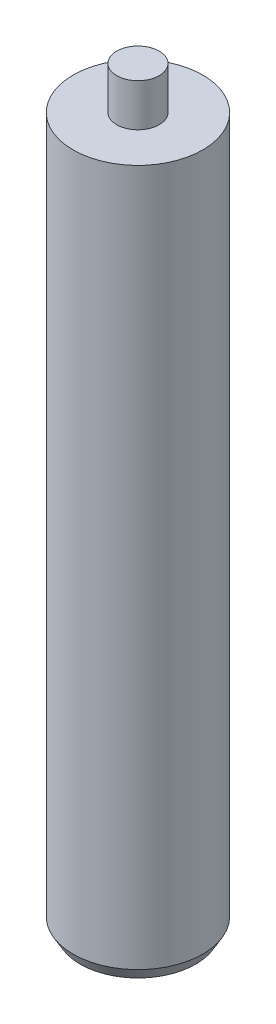
from build123d import *

# Parameters (mm, degrees)
SKETCH2_R           = 9.15
BOSS_EXTRUDE1_DEPTH = 100
SKETCH3_R           = 3
BOSS_EXTRUDE2_DEPTH = 6
CHAMFER1_SIZE       = 1
CHAMFER1_SIZE2      = 1.732050808


with BuildPart() as part:
    # Sketch2 → Boss-Extrude1 (new body)
    with BuildSketch(Plane(origin=(0, 0, 0), x_dir=(1, 0, 0), z_dir=(0, 1, 0))):
        with Locations(Location((0, 0, 0), (0, 0, 270))):
            Circle(SKETCH2_R)
    extrude(amount=BOSS_EXTRUDE1_DEPTH)

    # Sketch3 → Boss-Extrude2 (add)
    with BuildSketch(Plane(origin=(0, 100, 0), x_dir=(1, 0, 0), z_dir=(0, 1, 0))):
        with Locations(Location((0, 0, 0), (0, 0, 270))):
            Circle(SKETCH3_R)
    extrude(amount=BOSS_EXTRUDE2_DEPTH)

    # Chamfer1
    chamfer1_edges = [part.edges().sort_by_distance(p)[0] for p in [
        (0, 0, -9.15),
    ]]
    chamfer1_side = [part.faces().sort_by_distance(p)[0] for p in [
        (0, 0, 0),
    ]]
    chamfer(chamfer1_edges, length=CHAMFER1_SIZE, length2=CHAMFER1_SIZE2, reference=chamfer1_side[0])


solid = part.part
